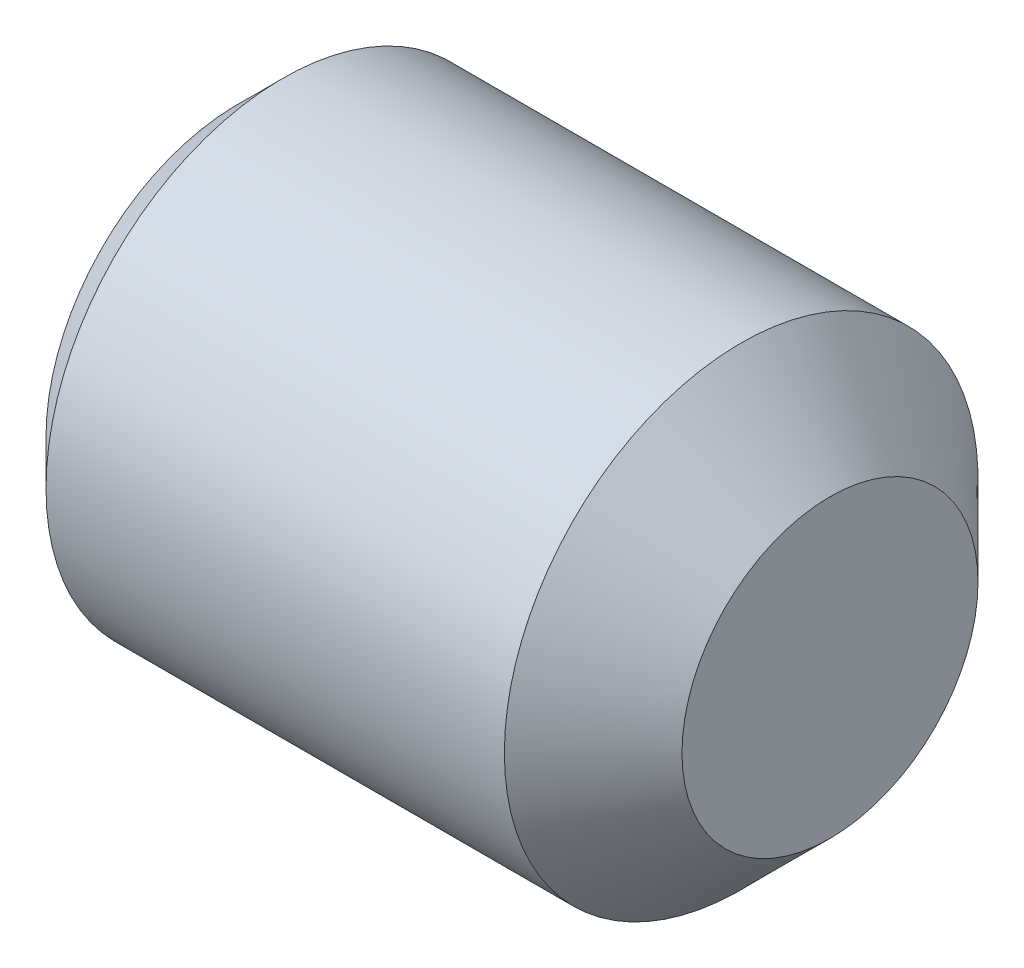
from build123d import *

# Parameters (mm, degrees)
CUT_EXTRUDE1_DEPTH = 2.5


with BuildPart() as part:
    # Sketch1 → Revolve1 (revolve)
    with BuildSketch(Plane.XY, mode=Mode.PRIVATE) as revolve1_sk:
        Polygon((5, 1.25), (5, 0), (0, 0), (0, 1.621), (0.379, 2), (4.25, 2), align=None)
    revolve(revolve1_sk.sketch.rotate(Axis((0, 0, 0), (1, 0, 0)), 90), axis=Axis((0, 0, 0), (1, 0, 0)))

    # Sketch2 → Cut-Revolve1 (revolve, cut)
    with BuildSketch(Plane.XY, mode=Mode.PRIVATE) as cut_revolve1_sk:
        Polygon((2.5, 1), (0, 1), (0, 0), (3.077350269, 0), align=None)
    revolve(cut_revolve1_sk.sketch.rotate(Axis((0, 0, 0), (1, 0, 0)), 90), axis=Axis((0, 0, 0), (1, 0, 0)), mode=Mode.SUBTRACT)

    # Sketch3 → Cut-Extrude1 (cut)
    with BuildSketch(Plane.ZY):
        Polygon((0, 1.154700538), (-1, 0.577350269), (-1, -0.577350269), (0, -1.154700538), (1, -0.577350269), (1, 0.577350269), align=None)
    extrude(amount=-CUT_EXTRUDE1_DEPTH, mode=Mode.SUBTRACT)


solid = part.part
